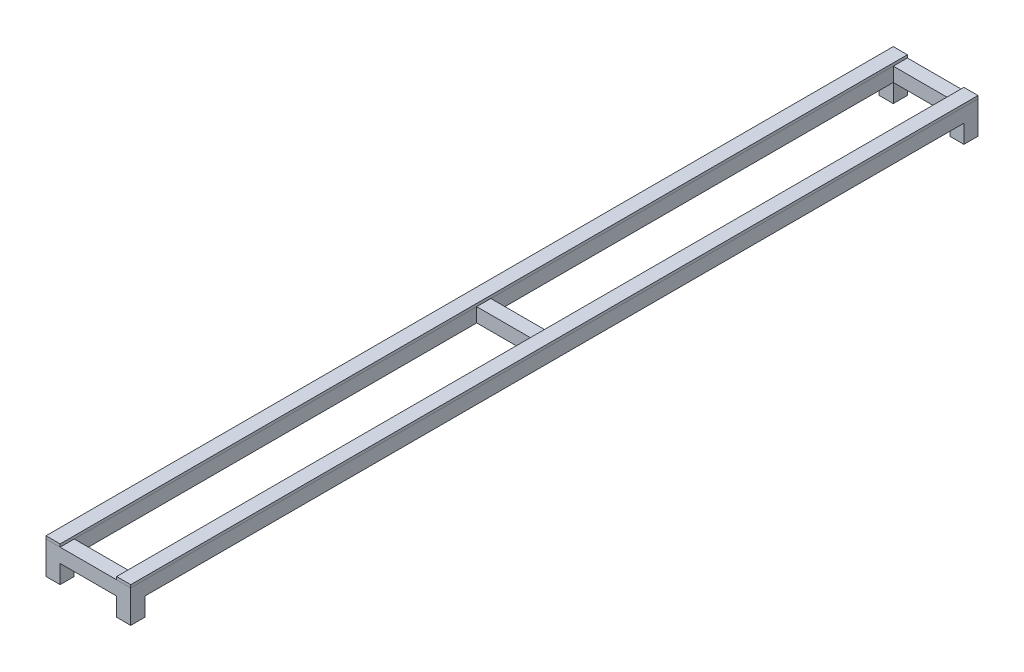
from build123d import *

# Parameters (mm, degrees)
SKETCH_1_W        = 100
SKETCH_1_H        = 100
EXTRUDE_1_DEPTH   = 3000
EXTRUDE_1_2_DEPTH = 3000
SKETCH_2_W        = 100
SKETCH_2_H        = 100
EXTRUDE_2_DEPTH   = 500
SKETCH_3_W        = 100
SKETCH_3_H        = 100
EXTRUDE_3_DEPTH   = 130
SKETCH_4_W        = 100
SKETCH_4_H        = 6000
EXTRUDE_4_DEPTH   = 20
EXTRUDE_4_2_DEPTH = 20


with BuildPart() as part:
    # 草图1 → 凸台-拉伸1 (new, symmetric)
    with BuildSketch(Plane.XY):
        with Locations((-250, 0)):
            Rectangle(SKETCH_1_W, SKETCH_1_H)
    extrude(amount=EXTRUDE_1_DEPTH, both=True)



with BuildPart() as body_2:
    # 草图1 → Extrude 1 2 (new, symmetric)
    with BuildSketch(Plane.XY):
        with Locations((250, 0)):
            Rectangle(SKETCH_1_W, SKETCH_1_H)
    extrude(amount=EXTRUDE_1_2_DEPTH, both=True)


with BuildPart() as part_1:
    add(part.part)

    add(body_2.part)  # 凸台-拉伸2 merges body 2
    # 草图2 → 凸台-拉伸2 (add)
    with BuildSketch(Plane(origin=(300, 0, 0), x_dir=(0, 0, -1), z_dir=(1, 0, 0))):
        with Locations((-2950, 0)):
            Rectangle(SKETCH_2_W, SKETCH_2_H)
        with Locations((2950, 0)):
            Rectangle(SKETCH_2_W, SKETCH_2_H)
        Rectangle(SKETCH_2_W, SKETCH_2_H)
    extrude(amount=-EXTRUDE_2_DEPTH)

    # 草图3 → 凸台-拉伸3 (add)
    with BuildSketch(Plane.XZ.offset(50)):
        with Locations((250, 2950)):
            Rectangle(SKETCH_3_W, SKETCH_3_H)
        with Locations((-250, 2950)):
            Rectangle(SKETCH_3_W, SKETCH_3_H)
        with Locations((250, -2950)):
            Rectangle(SKETCH_3_W, SKETCH_3_H)
        with Locations((-250, -2950)):
            Rectangle(SKETCH_3_W, SKETCH_3_H)
    extrude(amount=EXTRUDE_3_DEPTH)


with BuildPart() as body_2_2:
    # 草图4 → 凸台-拉伸4 (new body)
    with BuildSketch(Plane(origin=(0, 50, 0), x_dir=(1, 0, 0), z_dir=(0, 1, 0))):
        with Locations((250, 0)):
            Rectangle(SKETCH_4_W, SKETCH_4_H)
    extrude(amount=EXTRUDE_4_DEPTH)


with BuildPart() as body_3:
    # 草图4 → Extrude 4 2 (new body)
    with BuildSketch(Plane(origin=(0, 50, 0), x_dir=(1, 0, 0), z_dir=(0, 1, 0))):
        with Locations((-250, 0)):
            Rectangle(SKETCH_4_W, SKETCH_4_H)
    extrude(amount=EXTRUDE_4_2_DEPTH)


solid = Compound([part_1.part, body_2_2.part, body_3.part])
